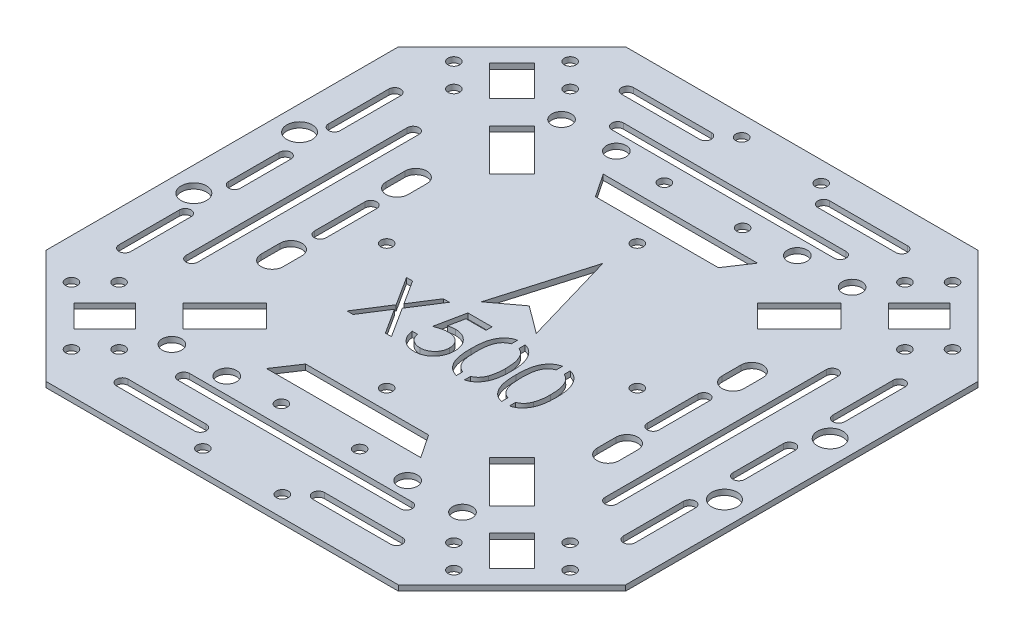
from build123d import *

# Parameters (mm, degrees)
BOSS_EXTRUDE1_DEPTH = 0.7
SKETCH3_R           = 1.5
CUT_EXTRUDE1_DEPTH  = 105.661167584
SKETCH4_R           = 3.25
SKETCH4_R_2         = 1.5
CUT_EXTRUDE2_DEPTH  = 105.661167584
SKETCH5_R           = 2.5
SKETCH5_R_2         = 1.5
CUT_EXTRUDE3_DEPTH  = 105.661167584
CUT_EXTRUDE4_DEPTH  = 105.661167584
SKETCH7_W           = 2
SKETCH7_H           = 20
BOSS_EXTRUDE2_DEPTH = 1.4


with BuildPart() as part:
    # Sketch1 → Boss-Extrude1 (new, symmetric)
    with BuildSketch(Plane(origin=(0, 0, 0), x_dir=(1, 0, 0), z_dir=(0, 1, 0))):
        Polygon((-74, 45), (-45, 74), (45, 74), (74, 45), (74, -45), (45, -74), (-45, -74), (-74, -45), align=None)
    extrude(amount=BOSS_EXTRUDE1_DEPTH, both=True)

    # Sketch3 → Cut-Extrude1 (cut, through all)
    with BuildSketch(Plane(origin=(0, 0.7, 0), x_dir=(1, 0, 0), z_dir=(0, 1, 0))):
        with Locations(Location((-48.822687604, 63.671930009, 0), (0, 0, 270))):
            Circle(SKETCH3_R)
        with Locations(Location((-63.671930009, 48.822687604, 0), (0, 0, 270))):
            Circle(SKETCH3_R)
        with Locations(Location((-57.590811691, 42.741569286, 0), (0, 0, 270))):
            Circle(SKETCH3_R)
        with Locations(Location((-42.741569286, 57.590811691, 0), (0, 0, 270))):
            Circle(SKETCH3_R)
        with Locations(Location((63.671930009, 48.822687604, 0), (0, 0, 270))):
            Circle(SKETCH3_R)
        with Locations(Location((48.822687604, 63.671930009, 0), (0, 0, 270))):
            Circle(SKETCH3_R)
        with Locations(Location((42.741569286, 57.590811691, 0), (0, 0, 270))):
            Circle(SKETCH3_R)
        with Locations(Location((57.590811691, 42.741569286, 0), (0, 0, 270))):
            Circle(SKETCH3_R)
        with Locations(Location((48.822687604, -63.671930009, 0), (0, 0, 270))):
            Circle(SKETCH3_R)
        with Locations(Location((63.671930009, -48.822687604, 0), (0, 0, 270))):
            Circle(SKETCH3_R)
        with Locations(Location((57.590811691, -42.741569286, 0), (0, 0, 270))):
            Circle(SKETCH3_R)
        with Locations(Location((42.741569286, -57.590811691, 0), (0, 0, 270))):
            Circle(SKETCH3_R)
        with Locations(Location((-63.671930009, -48.822687604, 0), (0, 0, 270))):
            Circle(SKETCH3_R)
        with Locations(Location((-48.822687604, -63.671930009, 0), (0, 0, 270))):
            Circle(SKETCH3_R)
        with Locations(Location((-42.741569286, -57.590811691, 0), (0, 0, 270))):
            Circle(SKETCH3_R)
        with Locations(Location((-57.590811691, -42.741569286, 0), (0, 0, 270))):
            Circle(SKETCH3_R)
        Polygon((-50.908652609, 45.181087681), (-58.75753788, 53.029972952), (-53.029972952, 58.75753788), (-45.181087681, 50.908652609), align=None)
        Polygon((-44.898244968, 39.170680041), (-34.220932573, 28.493367645), (-28.493367645, 34.220932573), (-39.170680041, 44.898244968), align=None)
        Polygon((45.181087681, 50.908652609), (53.029972952, 58.75753788), (58.75753788, 53.029972952), (50.908652609, 45.181087681), align=None)
        Polygon((39.170680041, 44.898244968), (28.493367645, 34.220932573), (34.220932573, 28.493367645), (44.898244968, 39.170680041), align=None)
        Polygon((50.908652609, -45.181087681), (58.75753788, -53.029972952), (53.029972952, -58.75753788), (45.181087681, -50.908652609), align=None)
        Polygon((44.898244968, -39.170680041), (34.220932573, -28.493367645), (28.493367645, -34.220932573), (39.170680041, -44.898244968), align=None)
        Polygon((-45.181087681, -50.908652609), (-53.029972952, -58.75753788), (-58.75753788, -53.029972952), (-50.908652609, -45.181087681), align=None)
        Polygon((-39.170680041, -44.898244968), (-28.493367645, -34.220932573), (-34.220932573, -28.493367645), (-44.898244968, -39.170680041), align=None)
    extrude(amount=-CUT_EXTRUDE1_DEPTH, mode=Mode.SUBTRACT)

    # Sketch4 → Cut-Extrude2 (cut, through all)
    with BuildSketch(Plane(origin=(0, 0.7, 0), x_dir=(1, 0, 0), z_dir=(0, 1, 0))):
        with Locations(Location((-67.75, 13.5, 0), (0, 0, 270))):
            Circle(SKETCH4_R)
        with Locations(Location((-67.75, -13.5, 0), (0, 0, 270))):
            Circle(SKETCH4_R)
        with Locations(Location((-32, 0, 0), (0, 0, 270))):
            Circle(SKETCH4_R_2)
        with Locations(Location((32, 0, 0), (0, 0, 90))):
            Circle(SKETCH4_R_2)
        with Locations(Location((67.75, -13.5, 0), (0, 0, 90))):
            Circle(SKETCH4_R)
        with Locations(Location((67.75, 13.5, 0), (0, 0, 90))):
            Circle(SKETCH4_R)
        with BuildLine():
            Line((-52, 28.25), (-52, -28.25))
            ThreePointArc((-52, -28.25), (-53.5, -29.75), (-55, -28.25))
            Line((-55, -28.25), (-55, 28.25))
            ThreePointArc((-55, 28.25), (-53.5, 29.75), (-52, 28.25))
        make_face()
        with BuildLine():
            Line((-62.9, 34.45), (-62.9, 19.05))
            ThreePointArc((-62.9, 19.05), (-64.4, 17.55), (-65.9, 19.05))
            Line((-65.9, 19.05), (-65.9, 34.45))
            ThreePointArc((-65.9, 34.45), (-64.4, 35.95), (-62.9, 34.45))
        make_face()
        with BuildLine():
            Line((-62.9, -19.05), (-62.9, -34.45))
            ThreePointArc((-62.9, -34.45), (-64.4, -35.95), (-65.9, -34.45))
            Line((-65.9, -34.45), (-65.9, -19.05))
            ThreePointArc((-65.9, -19.05), (-64.4, -17.55), (-62.9, -19.05))
        make_face()
        with BuildLine():
            Line((-62.9, 6.45), (-62.9, -6.45))
            ThreePointArc((-62.9, -6.45), (-64.4, -7.95), (-65.9, -6.45))
            Line((-65.9, -6.45), (-65.9, 6.45))
            ThreePointArc((-65.9, 6.45), (-64.4, 7.95), (-62.9, 6.45))
        make_face()
        with BuildLine():
            Line((-40.1, 18.35), (-40.1, 13.55))
            ThreePointArc((-40.1, 13.55), (-42.9, 10.75), (-45.7, 13.55))
            Line((-45.7, 13.55), (-45.7, 18.35))
            ThreePointArc((-45.7, 18.35), (-42.9, 21.15), (-40.1, 18.35))
        make_face()
        with BuildLine():
            Line((-41, 6.45), (-41, -6.45))
            ThreePointArc((-41, -6.45), (-42.5, -7.95), (-44, -6.45))
            Line((-44, -6.45), (-44, 6.45))
            ThreePointArc((-44, 6.45), (-42.5, 7.95), (-41, 6.45))
        make_face()
        with BuildLine():
            Line((-40.1, -13.55), (-40.1, -18.35))
            ThreePointArc((-40.1, -18.35), (-42.9, -21.15), (-45.7, -18.35))
            Line((-45.7, -18.35), (-45.7, -13.55))
            ThreePointArc((-45.7, -13.55), (-42.9, -10.75), (-40.1, -13.55))
        make_face()
        with BuildLine():
            Line((52, 28.25), (52, -28.25))
            ThreePointArc((52, -28.25), (53.5, -29.75), (55, -28.25))
            Line((55, -28.25), (55, 28.25))
            ThreePointArc((55, 28.25), (53.5, 29.75), (52, 28.25))
        make_face()
        with BuildLine():
            Line((62.9, 34.45), (62.9, 19.05))
            ThreePointArc((62.9, 19.05), (64.4, 17.55), (65.9, 19.05))
            Line((65.9, 19.05), (65.9, 34.45))
            ThreePointArc((65.9, 34.45), (64.4, 35.95), (62.9, 34.45))
        make_face()
        with BuildLine():
            Line((62.9, -19.05), (62.9, -34.45))
            ThreePointArc((62.9, -34.45), (64.4, -35.95), (65.9, -34.45))
            Line((65.9, -34.45), (65.9, -19.05))
            ThreePointArc((65.9, -19.05), (64.4, -17.55), (62.9, -19.05))
        make_face()
        with BuildLine():
            Line((62.9, 6.45), (62.9, -6.45))
            ThreePointArc((62.9, -6.45), (64.4, -7.95), (65.9, -6.45))
            Line((65.9, -6.45), (65.9, 6.45))
            ThreePointArc((65.9, 6.45), (64.4, 7.95), (62.9, 6.45))
        make_face()
        with BuildLine():
            Line((40.1, 18.35), (40.1, 13.55))
            ThreePointArc((40.1, 13.55), (42.9, 10.75), (45.7, 13.55))
            Line((45.7, 13.55), (45.7, 18.35))
            ThreePointArc((45.7, 18.35), (42.9, 21.15), (40.1, 18.35))
        make_face()
        with BuildLine():
            Line((41, 6.45), (41, -6.45))
            ThreePointArc((41, -6.45), (42.5, -7.95), (44, -6.45))
            Line((44, -6.45), (44, 6.45))
            ThreePointArc((44, 6.45), (42.5, 7.95), (41, 6.45))
        make_face()
        with BuildLine():
            Line((40.1, -13.55), (40.1, -18.35))
            ThreePointArc((40.1, -18.35), (42.9, -21.15), (45.7, -18.35))
            Line((45.7, -18.35), (45.7, -13.55))
            ThreePointArc((45.7, -13.55), (42.9, -10.75), (40.1, -13.55))
        make_face()
    extrude(amount=-CUT_EXTRUDE2_DEPTH, mode=Mode.SUBTRACT)

    # Sketch5 → Cut-Extrude3 (cut, through all)
    with BuildSketch(Plane(origin=(0, 0.7, 0), x_dir=(1, 0, 0), z_dir=(0, 1, 0))):
        with Locations(Location((-37.1, 49.75, 0), (0, 0, 270))):
            Circle(SKETCH5_R)
        with Locations(Location((-23.1, 49.75, 0), (0, 0, 270))):
            Circle(SKETCH5_R)
        with Locations(Location((-10, 48.9, 0), (0, 0, 270))):
            Circle(SKETCH5_R_2)
        with Locations(Location((10, 48.9, 0), (0, 0, 270))):
            Circle(SKETCH5_R_2)
        with Locations(Location((23.1, 49.75, 0), (0, 0, 270))):
            Circle(SKETCH5_R)
        with Locations(Location((37.1, 49.75, 0), (0, 0, 270))):
            Circle(SKETCH5_R)
        with Locations(Location((10.15, 68.8, 0), (0, 0, 270))):
            Circle(SKETCH5_R_2)
        with Locations(Location((-10.15, 68.8, 0), (0, 0, 270))):
            Circle(SKETCH5_R_2)
        with Locations(Location((0, 32, 0), (0, 0, 270))):
            Circle(SKETCH5_R_2)
        with Locations(Location((0, -32, 0), (0, 0, 90))):
            Circle(SKETCH5_R_2)
        with Locations(Location((-10.15, -68.8, 0), (0, 0, 90))):
            Circle(SKETCH5_R_2)
        with Locations(Location((10.15, -68.8, 0), (0, 0, 90))):
            Circle(SKETCH5_R_2)
        with Locations(Location((37.1, -49.75, 0), (0, 0, 90))):
            Circle(SKETCH5_R)
        with Locations(Location((23.1, -49.75, 0), (0, 0, 90))):
            Circle(SKETCH5_R)
        with Locations(Location((10, -48.9, 0), (0, 0, 90))):
            Circle(SKETCH5_R_2)
        with Locations(Location((-10, -48.9, 0), (0, 0, 90))):
            Circle(SKETCH5_R_2)
        with Locations(Location((-23.1, -49.75, 0), (0, 0, 90))):
            Circle(SKETCH5_R)
        with Locations(Location((-37.1, -49.75, 0), (0, 0, 90))):
            Circle(SKETCH5_R)
        with BuildLine():
            Line((-35, 66), (-15.1, 66))
            ThreePointArc((-15.1, 66), (-13.6, 64.5), (-15.1, 63))
            Line((-15.1, 63), (-35, 63))
            ThreePointArc((-35, 63), (-36.5, 64.5), (-35, 66))
        make_face()
        with BuildLine():
            Line((15.1, 66), (35, 66))
            ThreePointArc((35, 66), (36.5, 64.5), (35, 63))
            Line((35, 63), (15.1, 63))
            ThreePointArc((15.1, 63), (13.6, 64.5), (15.1, 66))
        make_face()
        with BuildLine():
            Line((-28.4, 56.9), (28.4, 56.9))
            ThreePointArc((28.4, 56.9), (29.9, 55.4), (28.4, 53.9))
            Line((28.4, 53.9), (-28.4, 53.9))
            ThreePointArc((-28.4, 53.9), (-29.9, 55.4), (-28.4, 56.9))
        make_face()
        Polygon((-19.7, 43), (-15.7, 37), (15.7, 37), (19.7, 43), align=None)
        with BuildLine():
            Line((-35, -66), (-15.1, -66))
            ThreePointArc((-15.1, -66), (-13.6, -64.5), (-15.1, -63))
            Line((-15.1, -63), (-35, -63))
            ThreePointArc((-35, -63), (-36.5, -64.5), (-35, -66))
        make_face()
        with BuildLine():
            Line((15.1, -66), (35, -66))
            ThreePointArc((35, -66), (36.5, -64.5), (35, -63))
            Line((35, -63), (15.1, -63))
            ThreePointArc((15.1, -63), (13.6, -64.5), (15.1, -66))
        make_face()
        with BuildLine():
            Line((-28.4, -56.9), (28.4, -56.9))
            ThreePointArc((28.4, -56.9), (29.9, -55.4), (28.4, -53.9))
            Line((28.4, -53.9), (-28.4, -53.9))
            ThreePointArc((-28.4, -53.9), (-29.9, -55.4), (-28.4, -56.9))
        make_face()
        Polygon((19.7, -43), (-19.7, -43), (-15.7, -37), (15.7, -37), align=None)
    extrude(amount=-CUT_EXTRUDE3_DEPTH, mode=Mode.SUBTRACT)

    # Sketch6 → Cut-Extrude4 (cut, through all)
    # profile 1 of 5: a face of its own
    with BuildSketch(Plane(origin=(0, 0.7, 0), x_dir=(1, 0, 0), z_dir=(0, 1, 0))):
        Polygon((0, 23.2), (-7, -0.8), (0, 4.4), (7, -0.8), align=None)
    # profile 2 of 5: a face of its own
    with BuildSketch(Plane(origin=(0, 0.7, 0), x_dir=(1, 0, 0), z_dir=(0, 1, 0))):
        Polygon((-21.949311431, -4.985558612), (-20.395825854, -4.985558612), (-16.468542201, -11.121375919), (-12.541258547, -4.985558612), (-10.98777297, -4.985558612), (-15.690297008, -12.335318227), (-10.795465277, -19.985558612), (-12.348950854, -19.985558612), (-16.468542201, -13.549260535), (-20.588133547, -19.985558612), (-22.141619124, -19.985558612), (-17.243782585, -12.335318227), align=None)
    # profile 3 of 5: a face of its own
    with BuildSketch(Plane(origin=(0, 0.7, 0), x_dir=(1, 0, 0), z_dir=(0, 1, 0))):
        with BuildLine():
            Line((-0.122388354, -4.985558612), (-0.122388354, -6.52402015))
            Line((-0.122388354, -6.52402015), (-5.224551816, -6.52402015))
            Line((-5.224551816, -6.52402015), (-6.032845085, -10.46933265))
            add(Edge.make_bspline(
                [(-6.032845085, -10.46933265), (-5.874034195, -10.425488628), (-5.566363213, -10.34054777), (-5.112249523, -10.246237325), (-4.68114008, -10.189385422), (-4.401388492, -10.181622662), (-4.266018162, -10.177866304)],
                knots=[0, 0, 0, 0, 1.100273476, 2.13160584, 3.095893838, 4, 4, 4, 4], degree=3))
            add(Edge.make_bspline(
                [(-4.266018162, -10.177866304), (-4.09851642, -10.181491743), (-3.769166146, -10.188620261), (-3.287284945, -10.257071044), (-2.827286831, -10.364813535), (-2.390133816, -10.515330057), (-1.97501717, -10.707800342), (-1.585756193, -10.948228658), (-1.216507994, -11.229085792), (-0.873896877, -11.551992986), (-0.563078414, -11.907371343), (-0.289795601, -12.289476505), (-0.057670214, -12.694595057), (0.129018736, -13.126597666), (0.278094454, -13.580708323), (0.377317289, -14.061705106), (0.443388899, -14.565054191), (0.450770555, -14.909216635), (0.454534723, -15.084717265)],
                knots=[0, 0, 0, 0, 1.052922333, 2.070308379, 3.05430497, 4.020497103, 4.973039431, 5.925935799, 6.892292201, 7.88610001, 8.88166317, 9.857072816, 10.836096531, 11.812156883, 12.81219415, 13.836441305, 14.89672472, 16, 16, 16, 16], degree=3))
            add(Edge.make_bspline(
                [(0.454534723, -15.084717265), (0.4516844, -15.206955353), (0.446022274, -15.449779585), (0.417228327, -15.810397588), (0.361789544, -16.163381158), (0.287356441, -16.508777123), (0.190746078, -16.845931576), (0.07379299, -17.175809552), (-0.069332842, -17.496357867), (-0.22632445, -17.81060956), (-0.403095071, -18.111460305), (-0.599288673, -18.392813105), (-0.80656935, -18.658888597), (-1.029603859, -18.906833167), (-1.270465267, -19.135017529), (-1.526236553, -19.344795878), (-1.794876778, -19.539715865), (-2.080542102, -19.711865273), (-2.376867029, -19.870277943), (-2.688130817, -20.00023596), (-3.007248104, -20.116423937), (-3.338811857, -20.209036198), (-3.682071054, -20.281604289), (-4.03759152, -20.330892577), (-4.403508677, -20.366791595), (-4.651544446, -20.369038839), (-4.77683547, -20.370173996)],
                knots=[0, 0, 0, 0, 1.056347294, 2.098418968, 3.122841568, 4.141288669, 5.149314143, 6.15115421, 7.162517403, 8.180376062, 9.185164535, 10.17417709, 11.141909838, 12.097768115, 13.052685741, 14.0056014, 14.954263652, 15.917497458, 16.885230207, 17.854509472, 18.828990115, 19.81800267, 20.826176721, 21.857883937, 22.917946725, 24, 24, 24, 24], degree=3))
            add(Edge.make_bspline(
                [(-4.77683547, -20.370173996), (-4.926296244, -20.367213262), (-5.220342661, -20.361388367), (-5.651145092, -20.300452002), (-6.065636259, -20.213178074), (-6.46047955, -20.081879775), (-6.839213537, -19.917362798), (-7.19673947, -19.709436348), (-7.542192796, -19.473811618), (-7.861530097, -19.195752963), (-8.15791344, -18.891828611), (-8.42322705, -18.562010149), (-8.659513807, -18.211741111), (-8.862989866, -17.839320451), (-9.036552814, -17.445726747), (-9.172902764, -17.029485315), (-9.282952856, -16.592771012), (-9.329510373, -16.29211311), (-9.353157585, -16.139404765)],
                knots=[0, 0, 0, 0, 1.0467383, 2.05933395, 3.04377827, 4.011590433, 4.970194871, 5.932262533, 6.905835911, 7.896367577, 8.894135286, 9.877477877, 10.858688626, 11.851381753, 12.8477658, 13.868841284, 14.917554742, 16, 16, 16, 16], degree=3))
            Line((-9.353157585, -16.139404765), (-8.007003739, -16.139404765))
            add(Edge.make_bspline(
                [(-8.007003739, -16.139404765), (-7.97388135, -16.282446704), (-7.91021828, -16.557381254), (-7.770479356, -16.943658431), (-7.599625604, -17.287883675), (-7.396464111, -17.594610461), (-7.154106838, -17.862077592), (-6.877552142, -18.100436429), (-6.567490471, -18.315472697), (-6.222948059, -18.494713128), (-5.859463434, -18.647579214), (-5.479032533, -18.749372193), (-5.092013906, -18.820947448), (-4.830249462, -18.828112137), (-4.69871047, -18.831712458)],
                knots=[0, 0, 0, 0, 1.136247022, 2.183929868, 3.172523383, 4.106158343, 5.02341133, 5.958108904, 6.928429099, 7.938127109, 8.96079061, 9.975095812, 10.982467395, 12, 12, 12, 12], degree=3))
            add(Edge.make_bspline(
                [(-4.69871047, -18.831712458), (-4.570317137, -18.828194838), (-4.317509613, -18.821268616), (-3.945460813, -18.767958565), (-3.58626278, -18.685854687), (-3.243459823, -18.56298388), (-2.911053225, -18.413649373), (-2.597451351, -18.222013334), (-2.293581878, -18.001470397), (-2.008889877, -17.748799126), (-1.74814938, -17.470357577), (-1.517766004, -17.17259732), (-1.325864947, -16.854953692), (-1.164147337, -16.522925894), (-1.041347485, -16.172874935), (-0.95374328, -15.806441327), (-0.902301599, -15.422719983), (-0.895225113, -15.16099437), (-0.891619124, -15.027625919)],
                knots=[0, 0, 0, 0, 1.027316725, 2.022795036, 3.002884548, 3.971462791, 4.93288096, 5.914575861, 6.907176829, 7.935150275, 8.956128384, 9.956726525, 10.942570165, 11.921478529, 12.907843606, 13.90538589, 14.932640048, 16, 16, 16, 16], degree=3))
            add(Edge.make_bspline(
                [(-0.891619124, -15.027625919), (-0.894441178, -14.907301269), (-0.899964949, -14.671782888), (-0.945095965, -14.32721486), (-1.023597275, -14.001187536), (-1.13255676, -13.692126533), (-1.270897508, -13.399740352), (-1.439953132, -13.123727237), (-1.642896266, -12.867725094), (-1.874718646, -12.63161415), (-2.128681678, -12.413707544), (-2.409154861, -12.227947173), (-2.710268833, -12.07167324), (-3.028395688, -11.93681039), (-3.371102396, -11.839950053), (-3.731602249, -11.767230544), (-4.11378814, -11.725164704), (-4.375091089, -11.719328039), (-4.509407585, -11.716327842)],
                knots=[0, 0, 0, 0, 1.045622112, 2.046656509, 3.013763289, 3.955457236, 4.890082067, 5.820317437, 6.762574623, 7.722996705, 8.69280354, 9.665887285, 10.63943826, 11.638615906, 12.663482002, 13.728887084, 14.832589034, 16, 16, 16, 16], degree=3))
            add(Edge.make_bspline(
                [(-4.509407585, -11.716327842), (-4.625674423, -11.71881609), (-4.865735946, -11.723953691), (-5.233976632, -11.761781534), (-5.620941159, -11.822807082), (-6.02514614, -11.906748142), (-6.44780546, -12.016595614), (-6.888027178, -12.148229188), (-7.346736892, -12.305609183), (-7.655812853, -12.424461527), (-7.814696047, -12.485558612)],
                knots=[0, 0, 0, 0, 0.817624296, 1.688186739, 2.600797293, 3.572016777, 4.590301741, 5.671205678, 6.80286297, 8, 8, 8, 8], degree=3))
            Line((-7.814696047, -12.485558612), (-6.276234508, -4.985558612))
            Line((-6.276234508, -4.985558612), (-0.122388354, -4.985558612))
        make_face()
    # profile 4 of 5: a face of its own
    with BuildSketch(Plane(origin=(0, 0.7, 0), x_dir=(1, 0, 0), z_dir=(0, 1, 0))):
        with BuildLine():
            add(Edge.make_bspline(
                [(1.992996261, -12.491568227), (1.994402053, -12.251150851), (1.997132825, -11.784136633), (2.027511771, -11.103631024), (2.077977524, -10.465229785), (2.147137694, -9.868902359), (2.231300466, -9.314494797), (2.343652551, -8.803488695), (2.471421705, -8.333518953), (2.619503616, -7.903053031), (2.78659414, -7.506291446), (2.968455258, -7.135897726), (3.172304377, -6.792432302), (3.386491146, -6.4704132), (3.619685739, -6.175111651), (3.865251984, -5.902357383), (4.132774311, -5.658454167), (4.413158632, -5.436255728), (4.708943479, -5.241472278), (5.011697763, -5.069903398), (5.323505359, -4.923332539), (5.645217572, -4.808087813), (5.97394282, -4.71289847), (6.310830249, -4.64780298), (6.656436094, -4.606844801), (6.889713672, -4.602929082), (7.008020299, -4.600943227)],
                knots=[0, 0, 0, 0, 1.646270934, 3.197905019, 4.663502075, 6.030701355, 7.308322542, 8.50163776, 9.611534131, 10.641858119, 11.616356847, 12.558055219, 13.465016945, 14.349605745, 15.204443733, 16.039544428, 16.859896111, 17.680448484, 18.487036065, 19.28249412, 20.06191084, 20.843045899, 21.620316918, 22.403196591, 23.190181807, 24, 24, 24, 24], degree=3))
            add(Edge.make_bspline(
                [(7.008020299, -4.600943227), (7.127315207, -4.603033863), (7.364555245, -4.607191482), (7.715299711, -4.647151235), (8.057941204, -4.713456049), (8.391018941, -4.807403082), (8.717268883, -4.923955982), (9.034139202, -5.070043627), (9.343598123, -5.240095916), (9.640727927, -5.439912533), (9.928790564, -5.662693717), (10.200710405, -5.914533726), (10.456512202, -6.192889665), (10.699406368, -6.494783368), (10.922501784, -6.82600516), (11.134959351, -7.180794202), (11.325125219, -7.565355051), (11.508273827, -7.973271342), (11.666360913, -8.41582988), (11.808930536, -8.890535996), (11.924126115, -9.402996797), (12.02008014, -9.950523562), (12.094415408, -10.535127062), (12.148555303, -11.155554129), (12.177154238, -11.812212946), (12.182540101, -12.261175156), (12.185303953, -12.491568227)],
                knots=[0, 0, 0, 0, 0.810914788, 1.612654377, 2.396697861, 3.181598691, 3.963628158, 4.749916497, 5.551656086, 6.361998678, 7.18212741, 8.025565596, 8.878627764, 9.750805457, 10.657531673, 11.591944965, 12.560506719, 13.57287815, 14.630710178, 15.753379473, 16.941251878, 18.199788006, 19.531962791, 20.947069417, 22.433333509, 24, 24, 24, 24], degree=3))
            add(Edge.make_bspline(
                [(12.185303953, -12.491568227), (12.182511448, -12.720956404), (12.177070366, -13.167909912), (12.148875908, -13.821614092), (12.093338917, -14.438748563), (12.023867539, -15.020793402), (11.927649126, -15.565326054), (11.809341271, -16.074230833), (11.677982744, -16.549705426), (11.515833627, -16.987854619), (11.338359154, -17.394790574), (11.145265456, -17.774792638), (10.938394773, -18.131219607), (10.713014437, -18.461218522), (10.472785523, -18.767127053), (10.212566428, -19.043545435), (9.939692492, -19.29713403), (9.650782139, -19.522783862), (9.349018348, -19.720290167), (9.040622304, -19.896920954), (8.720122089, -20.03934679), (8.394780863, -20.161639823), (8.059945009, -20.255070331), (7.716031906, -20.319672569), (7.364790895, -20.364980491), (7.127355616, -20.368436833), (7.008020299, -20.370173996)],
                knots=[0, 0, 0, 0, 1.561518951, 3.042555995, 4.452378317, 5.7783523, 7.031515105, 8.214008947, 9.334062868, 10.386615937, 11.391082383, 12.354592575, 13.286541444, 14.194233754, 15.072674879, 15.931287219, 16.775624067, 17.606195743, 18.42308326, 19.229000347, 20.022332153, 20.807536673, 21.593273796, 22.3848459, 23.188221202, 24, 24, 24, 24], degree=3))
            add(Edge.make_bspline(
                [(7.008020299, -20.370173996), (6.889716954, -20.36817533), (6.656445848, -20.36423435), (6.310792596, -20.323461215), (5.97529641, -20.257909059), (5.648301749, -20.166123612), (5.328130971, -20.053774314), (5.019146885, -19.907401384), (4.717913955, -19.738826803), (4.425235858, -19.546846425), (4.14661231, -19.326896355), (3.88047543, -19.083620832), (3.633511063, -18.810949069), (3.403650653, -18.513186542), (3.185190275, -18.193072646), (2.984235818, -17.846236761), (2.798360729, -17.474054145), (2.628460055, -17.074120242), (2.477822925, -16.640599123), (2.344761319, -16.168531215), (2.239700644, -15.653749917), (2.149773693, -15.100389773), (2.077240623, -14.506072928), (2.027722086, -13.870476736), (1.99711645, -13.193997269), (1.994394719, -12.72998395), (1.992996261, -12.491568227)],
                knots=[0, 0, 0, 0, 0.810891512, 1.598919785, 2.382837074, 3.152667961, 3.926044502, 4.706494248, 5.493654104, 6.291793342, 7.103789334, 7.925228297, 8.761435821, 9.622817696, 10.50288917, 11.416980706, 12.369136599, 13.353924996, 14.394355917, 15.514179734, 16.714354668, 17.994756427, 19.357759367, 20.818452758, 22.365282078, 24, 24, 24, 24], degree=3))
        make_face()
        with BuildLine():
            add(Edge.make_bspline(
                [(3.339150107, -12.485558612), (3.339662023, -12.685910178), (3.340655552, -13.074753227), (3.366610697, -13.639795774), (3.401968834, -14.166811469), (3.447574393, -14.656469482), (3.515301316, -15.107112393), (3.591187549, -15.521839606), (3.683536505, -15.898456337), (3.792800867, -16.239546954), (3.917254139, -16.550900105), (4.053136412, -16.840619598), (4.199110939, -17.112127897), (4.362478727, -17.362986219), (4.540400427, -17.594012636), (4.728857252, -17.809296203), (4.934882613, -18.001283266), (5.219898652, -18.231541216), (5.596169257, -18.469480361), (6.070256922, -18.676677889), (6.557407426, -18.806888416), (6.888055641, -18.82344737), (7.053092415, -18.831712458)],
                knots=[0, 0, 0, 0, 1.459021318, 2.831673884, 4.118529203, 5.306027144, 6.411944654, 7.436330062, 8.375795394, 9.233974572, 10.042671642, 10.816086306, 11.563610507, 12.285937304, 12.993564865, 13.685989202, 14.367179055, 15.041617293, 16.353048772, 17.594441528, 18.799311195, 20, 20, 20, 20], degree=3))
            add(Edge.make_bspline(
                [(7.053092415, -18.831712458), (7.219196722, -18.824864826), (7.551062393, -18.811183699), (8.035921515, -18.679189111), (8.506622672, -18.480033941), (8.875502416, -18.244544633), (9.156141888, -18.020280363), (9.357214703, -17.829074728), (9.541766339, -17.614978154), (9.716803803, -17.383981171), (9.877342699, -17.131670525), (10.023327575, -16.859259488), (10.156541921, -16.565991583), (10.232437832, -16.361264129), (10.271241453, -16.256592265)],
                knots=[0, 0, 0, 0, 1.353760809, 2.704726607, 4.075137775, 5.516104923, 6.260822281, 7.007110065, 7.778089737, 8.566572457, 9.372053459, 10.217411131, 11.088608312, 12, 12, 12, 12], degree=3))
            add(Edge.make_bspline(
                [(10.271241453, -16.256592265), (10.316463315, -16.122750525), (10.408283089, -15.850994392), (10.526619264, -15.429435883), (10.619813832, -14.987138324), (10.703656828, -14.526744966), (10.760884211, -14.044860533), (10.806946268, -13.542976031), (10.834077783, -13.02071305), (10.837441002, -12.665877373), (10.839150107, -12.485558612)],
                knots=[0, 0, 0, 0, 0.884706709, 1.796334032, 2.740027952, 3.714592787, 4.726048262, 5.777819803, 6.87074269, 8, 8, 8, 8], degree=3))
            add(Edge.make_bspline(
                [(10.839150107, -12.485558612), (10.836792153, -12.305269015), (10.832179492, -11.952584023), (10.814548116, -11.436077535), (10.769018511, -10.945501416), (10.718450858, -10.478742248), (10.643891339, -10.038383808), (10.563500739, -9.620739642), (10.455495543, -9.230983822), (10.340125079, -8.863014186), (10.208080527, -8.521011381), (10.06272738, -8.203380868), (9.907491271, -7.90858919), (9.738881669, -7.637445155), (9.55890017, -7.388734257), (9.362796388, -7.167443137), (9.158349076, -6.966713274), (8.871989708, -6.737587978), (8.497099894, -6.503966426), (8.030618549, -6.288970312), (7.54517293, -6.165506201), (7.217000984, -6.14809897), (7.053092415, -6.139404765)],
                knots=[0, 0, 0, 0, 1.31362396, 2.569729283, 3.763502607, 4.902122613, 5.988968491, 7.01645872, 7.998833611, 8.933434873, 9.825090667, 10.667526885, 11.477055099, 12.250526234, 12.991942729, 13.710640831, 14.402115721, 15.076753259, 16.378508321, 17.609869233, 18.806226677, 20, 20, 20, 20], degree=3))
            add(Edge.make_bspline(
                [(7.053092415, -6.139404765), (6.887189877, -6.148110965), (6.555082568, -6.165539226), (6.064591333, -6.288510313), (5.594429826, -6.502851595), (5.220531363, -6.738361763), (4.933972278, -6.962668812), (4.732189306, -7.157182186), (4.542991426, -7.369951848), (4.368701282, -7.603102912), (4.205461497, -7.853668772), (4.055542872, -8.12362062), (3.920468602, -8.414326467), (3.795820589, -8.725539762), (3.686222926, -9.066600952), (3.595820227, -9.442753782), (3.512304285, -9.85616189), (3.453181704, -10.309245495), (3.400622751, -10.799026152), (3.366845545, -11.327357516), (3.340568727, -11.893347718), (3.339632452, -12.284201254), (3.339150107, -12.485558612)],
                knots=[0, 0, 0, 0, 1.207732386, 2.417664972, 3.655092373, 4.956220595, 5.625982001, 6.301752483, 6.994047911, 7.697131622, 8.419323945, 9.170223765, 9.943494443, 10.752040957, 11.610060368, 12.549350801, 13.567764191, 14.679664412, 15.874934091, 17.154273443, 18.533957287, 20, 20, 20, 20], degree=3))
        make_face(mode=Mode.SUBTRACT)
    # profile 5 of 5: a face of its own
    with BuildSketch(Plane(origin=(0, 0.7, 0), x_dir=(1, 0, 0), z_dir=(0, 1, 0))):
        with BuildLine():
            add(Edge.make_bspline(
                [(13.531457799, -12.491568227), (13.532863592, -12.251150851), (13.535594363, -11.784136633), (13.56597331, -11.103631024), (13.616439063, -10.465229785), (13.685599232, -9.868902359), (13.769762004, -9.314494797), (13.88211409, -8.803488695), (14.009883244, -8.333518953), (14.157965155, -7.903053031), (14.325055679, -7.506291446), (14.506916796, -7.135897726), (14.710765915, -6.792432302), (14.924952685, -6.4704132), (15.158147278, -6.175111651), (15.403713522, -5.902357383), (15.671235849, -5.658454167), (15.951620171, -5.436255728), (16.247405018, -5.241472278), (16.550159301, -5.069903398), (16.861966898, -4.923332539), (17.18367911, -4.808087813), (17.512404358, -4.71289847), (17.849291787, -4.64780298), (18.194897633, -4.606844801), (18.42817521, -4.602929082), (18.546481838, -4.600943227)],
                knots=[0, 0, 0, 0, 1.646270934, 3.197905019, 4.663502075, 6.030701355, 7.308322542, 8.50163776, 9.611534131, 10.641858119, 11.616356847, 12.558055219, 13.465016945, 14.349605745, 15.204443733, 16.039544428, 16.859896111, 17.680448484, 18.487036065, 19.28249412, 20.06191084, 20.843045899, 21.620316918, 22.403196591, 23.190181807, 24, 24, 24, 24], degree=3))
            add(Edge.make_bspline(
                [(18.546481838, -4.600943227), (18.665776746, -4.603033863), (18.903016784, -4.607191482), (19.253761249, -4.647151235), (19.596402742, -4.713456049), (19.92948048, -4.807403082), (20.255730422, -4.923955982), (20.57260074, -5.070043627), (20.882059661, -5.240095916), (21.179189465, -5.439912533), (21.467252102, -5.662693717), (21.739171944, -5.914533726), (21.99497374, -6.192889665), (22.237867906, -6.494783368), (22.460963323, -6.82600516), (22.673420889, -7.180794202), (22.863586758, -7.565355051), (23.046735366, -7.973271342), (23.204822452, -8.41582988), (23.347392074, -8.890535996), (23.462587654, -9.402996797), (23.558541678, -9.950523562), (23.632876946, -10.535127062), (23.687016841, -11.155554129), (23.715615777, -11.812212946), (23.721001639, -12.261175156), (23.723765492, -12.491568227)],
                knots=[0, 0, 0, 0, 0.810914788, 1.612654377, 2.396697861, 3.181598691, 3.963628158, 4.749916497, 5.551656086, 6.361998678, 7.18212741, 8.025565596, 8.878627764, 9.750805457, 10.657531673, 11.591944965, 12.560506719, 13.57287815, 14.630710178, 15.753379473, 16.941251878, 18.199788006, 19.531962791, 20.947069417, 22.433333509, 24, 24, 24, 24], degree=3))
            add(Edge.make_bspline(
                [(23.723765492, -12.491568227), (23.720972987, -12.720956404), (23.715531904, -13.167909912), (23.687337447, -13.821614092), (23.631800456, -14.438748563), (23.562329077, -15.020793402), (23.466110665, -15.565326054), (23.347802809, -16.074230833), (23.216444283, -16.549705426), (23.054295165, -16.987854619), (22.876820692, -17.394790574), (22.683726994, -17.774792638), (22.476856311, -18.131219607), (22.251475975, -18.461218522), (22.011247062, -18.767127053), (21.751027967, -19.043545435), (21.478154031, -19.29713403), (21.189243677, -19.522783862), (20.887479886, -19.720290167), (20.579083842, -19.896920954), (20.258583628, -20.03934679), (19.933242402, -20.161639823), (19.598406547, -20.255070331), (19.254493444, -20.319672569), (18.903252433, -20.364980491), (18.665817154, -20.368436833), (18.546481838, -20.370173996)],
                knots=[0, 0, 0, 0, 1.561518951, 3.042555995, 4.452378317, 5.7783523, 7.031515105, 8.214008947, 9.334062868, 10.386615937, 11.391082383, 12.354592575, 13.286541444, 14.194233754, 15.072674879, 15.931287219, 16.775624067, 17.606195743, 18.42308326, 19.229000347, 20.022332153, 20.807536673, 21.593273796, 22.3848459, 23.188221202, 24, 24, 24, 24], degree=3))
            add(Edge.make_bspline(
                [(18.546481838, -20.370173996), (18.428178492, -20.36817533), (18.194907386, -20.36423435), (17.849254134, -20.323461215), (17.513757948, -20.257909059), (17.186763288, -20.166123612), (16.866592509, -20.053774314), (16.557608423, -19.907401384), (16.256375493, -19.738826803), (15.963697396, -19.546846425), (15.685073849, -19.326896355), (15.418936969, -19.083620832), (15.171972601, -18.810949069), (14.942112191, -18.513186542), (14.723651813, -18.193072646), (14.522697356, -17.846236761), (14.336822268, -17.474054145), (14.166921593, -17.074120242), (14.016284464, -16.640599123), (13.883222858, -16.168531215), (13.778162183, -15.653749917), (13.688235231, -15.100389773), (13.615702161, -14.506072928), (13.566183624, -13.870476736), (13.535577988, -13.193997269), (13.532856258, -12.72998395), (13.531457799, -12.491568227)],
                knots=[0, 0, 0, 0, 0.810891512, 1.598919785, 2.382837074, 3.152667961, 3.926044502, 4.706494248, 5.493654104, 6.291793342, 7.103789334, 7.925228297, 8.761435821, 9.622817696, 10.50288917, 11.416980706, 12.369136599, 13.353924996, 14.394355917, 15.514179734, 16.714354668, 17.994756427, 19.357759367, 20.818452758, 22.365282078, 24, 24, 24, 24], degree=3))
        make_face()
        with BuildLine():
            add(Edge.make_bspline(
                [(14.877611646, -12.485558612), (14.878123562, -12.685910178), (14.87911709, -13.074753227), (14.905072235, -13.639795774), (14.940430373, -14.166811469), (14.986035932, -14.656469482), (15.053762854, -15.107112393), (15.129649088, -15.521839606), (15.221998043, -15.898456337), (15.331262405, -16.239546954), (15.455715678, -16.550900105), (15.591597951, -16.840619598), (15.737572477, -17.112127897), (15.900940266, -17.362986219), (16.078861965, -17.594012636), (16.26731879, -17.809296203), (16.473344151, -18.001283266), (16.758360191, -18.231541216), (17.134630795, -18.469480361), (17.60871846, -18.676677889), (18.095868965, -18.806888416), (18.426517179, -18.82344737), (18.591553953, -18.831712458)],
                knots=[0, 0, 0, 0, 1.459021318, 2.831673884, 4.118529203, 5.306027144, 6.411944654, 7.436330062, 8.375795394, 9.233974572, 10.042671642, 10.816086306, 11.563610507, 12.285937304, 12.993564865, 13.685989202, 14.367179055, 15.041617293, 16.353048772, 17.594441528, 18.799311195, 20, 20, 20, 20], degree=3))
            add(Edge.make_bspline(
                [(18.591553953, -18.831712458), (18.75765826, -18.824864826), (19.089523931, -18.811183699), (19.574383053, -18.679189111), (20.045084211, -18.480033941), (20.413963955, -18.244544633), (20.694603427, -18.020280363), (20.895676242, -17.829074728), (21.080227878, -17.614978154), (21.255265342, -17.383981171), (21.415804237, -17.131670525), (21.561789113, -16.859259488), (21.69500346, -16.565991583), (21.770899371, -16.361264129), (21.809702992, -16.256592265)],
                knots=[0, 0, 0, 0, 1.353760809, 2.704726607, 4.075137775, 5.516104923, 6.260822281, 7.007110065, 7.778089737, 8.566572457, 9.372053459, 10.217411131, 11.088608312, 12, 12, 12, 12], degree=3))
            add(Edge.make_bspline(
                [(21.809702992, -16.256592265), (21.854924854, -16.122750525), (21.946744627, -15.850994392), (22.065080803, -15.429435883), (22.158275371, -14.987138324), (22.242118367, -14.526744966), (22.299345749, -14.044860533), (22.345407806, -13.542976031), (22.372539322, -13.02071305), (22.375902541, -12.665877373), (22.377611646, -12.485558612)],
                knots=[0, 0, 0, 0, 0.884706709, 1.796334032, 2.740027952, 3.714592787, 4.726048262, 5.777819803, 6.87074269, 8, 8, 8, 8], degree=3))
            add(Edge.make_bspline(
                [(22.377611646, -12.485558612), (22.375253692, -12.305269015), (22.37064103, -11.952584023), (22.353009654, -11.436077535), (22.307480049, -10.945501416), (22.256912397, -10.478742248), (22.182352878, -10.038383808), (22.101962277, -9.620739642), (21.993957081, -9.230983822), (21.878586617, -8.863014186), (21.746542065, -8.521011381), (21.601188918, -8.203380868), (21.445952809, -7.90858919), (21.277343207, -7.637445155), (21.097361708, -7.388734257), (20.901257926, -7.167443137), (20.696810614, -6.966713274), (20.410451246, -6.737587978), (20.035561433, -6.503966426), (19.569080087, -6.288970312), (19.083634469, -6.165506201), (18.755462523, -6.14809897), (18.591553953, -6.139404765)],
                knots=[0, 0, 0, 0, 1.31362396, 2.569729283, 3.763502607, 4.902122613, 5.988968491, 7.01645872, 7.998833611, 8.933434873, 9.825090667, 10.667526885, 11.477055099, 12.250526234, 12.991942729, 13.710640831, 14.402115721, 15.076753259, 16.378508321, 17.609869233, 18.806226677, 20, 20, 20, 20], degree=3))
            add(Edge.make_bspline(
                [(18.591553953, -6.139404765), (18.425651416, -6.148110965), (18.093544106, -6.165539226), (17.603052872, -6.288510313), (17.132891364, -6.502851595), (16.758992902, -6.738361763), (16.472433817, -6.962668812), (16.270650845, -7.157182186), (16.081452964, -7.369951848), (15.907162821, -7.603102912), (15.743923035, -7.853668772), (15.59400441, -8.12362062), (15.45893014, -8.414326467), (15.334282128, -8.725539762), (15.224684465, -9.066600952), (15.134281765, -9.442753782), (15.050765823, -9.85616189), (14.991643242, -10.309245495), (14.939084289, -10.799026152), (14.905307084, -11.327357516), (14.879030266, -11.893347718), (14.87809399, -12.284201254), (14.877611646, -12.485558612)],
                knots=[0, 0, 0, 0, 1.207732386, 2.417664972, 3.655092373, 4.956220595, 5.625982001, 6.301752483, 6.994047911, 7.697131622, 8.419323945, 9.170223765, 9.943494443, 10.752040957, 11.610060368, 12.549350801, 13.567764191, 14.679664412, 15.874934091, 17.154273443, 18.533957287, 20, 20, 20, 20], degree=3))
        make_face(mode=Mode.SUBTRACT)
    extrude(amount=-CUT_EXTRUDE4_DEPTH, mode=Mode.SUBTRACT)


with BuildPart() as cut_extrude4_piece_1:
    # of the separate pieces the step leaves, piece 1, a body of its own (cut_extrude4_pieces)
    add(part.part.solids().sort_by_distance((-74, -0.7, -45))[0])



with BuildPart() as cut_extrude4_piece_2:
    # of the separate pieces the step leaves, piece 2, a body of its own (cut_extrude4_pieces)
    add(part.part.solids().sort_by_distance((21.809702992, -0.7, 16.256592265))[0])


with BuildPart() as cut_extrude4_piece_3:
    # of the separate pieces the step leaves, piece 3, a body of its own (cut_extrude4_pieces)
    add(part.part.solids().sort_by_distance((10.271241453, -0.7, 16.256592265))[0])


with BuildPart() as cut_extrude4_piece_1_1:
    add(cut_extrude4_piece_1.part)

    add(cut_extrude4_piece_2.part)  # Boss-Extrude2 merges Cut-Extrude4 piece 2

    add(cut_extrude4_piece_3.part)  # Boss-Extrude2 merges Cut-Extrude4 piece 3
    # Sketch7 → Boss-Extrude2 (add)
    with BuildSketch(Plane(origin=(0, 0.7, 0), x_dir=(1, 0, 0), z_dir=(0, 1, 0))):
        with Locations((7.1, -12)):
            Rectangle(SKETCH7_W, SKETCH7_H)
        with Locations((18.6, -12)):
            Rectangle(SKETCH7_W, SKETCH7_H)
    extrude(amount=-BOSS_EXTRUDE2_DEPTH)


solid = cut_extrude4_piece_1_1.part
